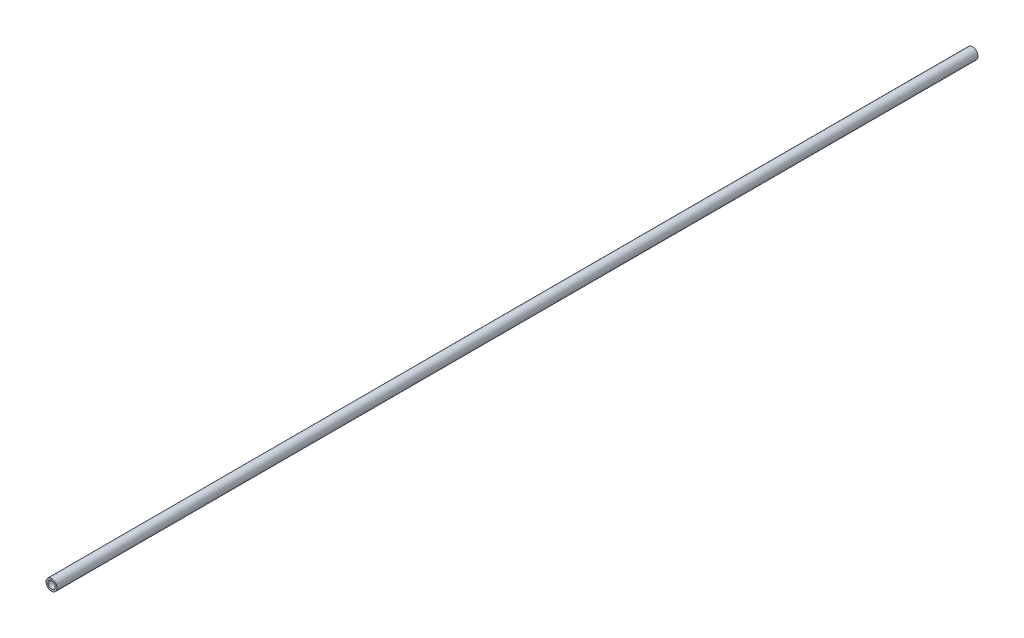
from build123d import *

# Parameters (mm, degrees)
SKETCH_1_R      = 3
SKETCH_1_R_2    = 2
EXTRUDE_1_DEPTH = 500


with BuildPart() as part:
    # Эскиз1 → Бобышка-Вытянуть1 (new body)
    with BuildSketch(Plane.XY):
        Circle(SKETCH_1_R)
        Circle(SKETCH_1_R_2, mode=Mode.SUBTRACT)
    extrude(amount=EXTRUDE_1_DEPTH)


solid = part.part
